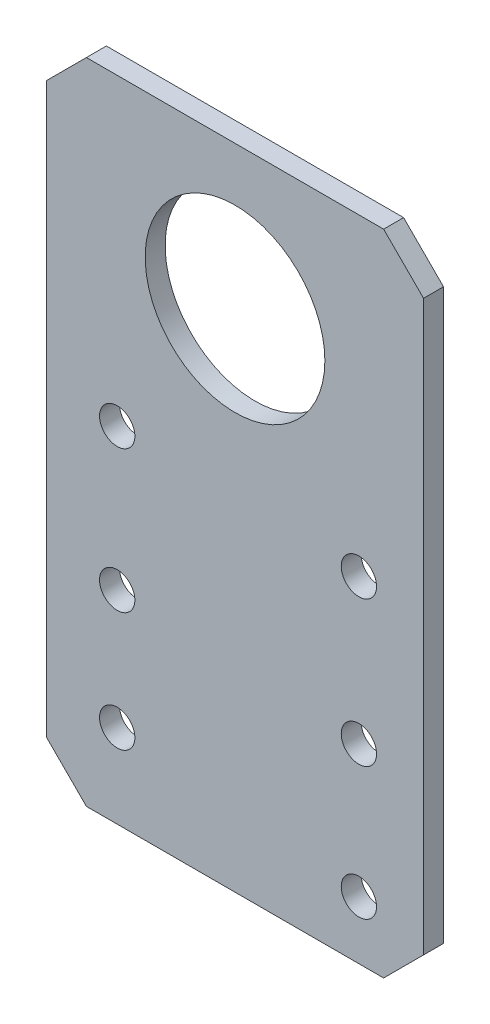
from build123d import *

# Parameters (mm, degrees)
SKETCH1_W              = 59.960812413
SKETCH1_H              = 103.12305947
SKETCH1_R              = 14.2875
BOSS_EXTRUDE1_DEPTH    = 3.175
CHAMFER1_SIZE          = 6.35
F_10_CLEARANCE_HOLE1_D = 5.6134


with BuildPart() as part:
    # Sketch1 → Boss-Extrude1 (new body)
    with BuildSketch(Plane.XY):
        with Locations((293.869593794, 80.109690656)):
            Rectangle(SKETCH1_W, SKETCH1_H)
        with Locations((293.869593793, 108.878190342)):
            Circle(SKETCH1_R, mode=Mode.SUBTRACT)
    extrude(amount=BOSS_EXTRUDE1_DEPTH)

    # Chamfer1
    chamfer1_edges = [part.edges().sort_by_distance(p)[0] for p in [
        (323.85, 28.548160921, 1.5875),
        (263.889187587, 28.548160921, 1.5875),
        (263.889187587, 131.671220391, 1.5875),
        (323.85, 131.671220391, 1.5875),
    ]]
    chamfer(chamfer1_edges, length=CHAMFER1_SIZE)

    # #10 Clearance Hole1 (through all)
    with Locations(Plane(origin=(0, 0, 0), x_dir=(1, 0, 0), z_dir=(0, 0, -1))):
        with Locations((275.136823716, -83.363402248), (275.136823716, -60.793377217), (313.56584092, -58.826399941), (313.56584092, -81.885554343), (275.136823716, -41.847646884), (313.56584092, -37.78667564)):
            Hole(F_10_CLEARANCE_HOLE1_D / 2)


solid = part.part
